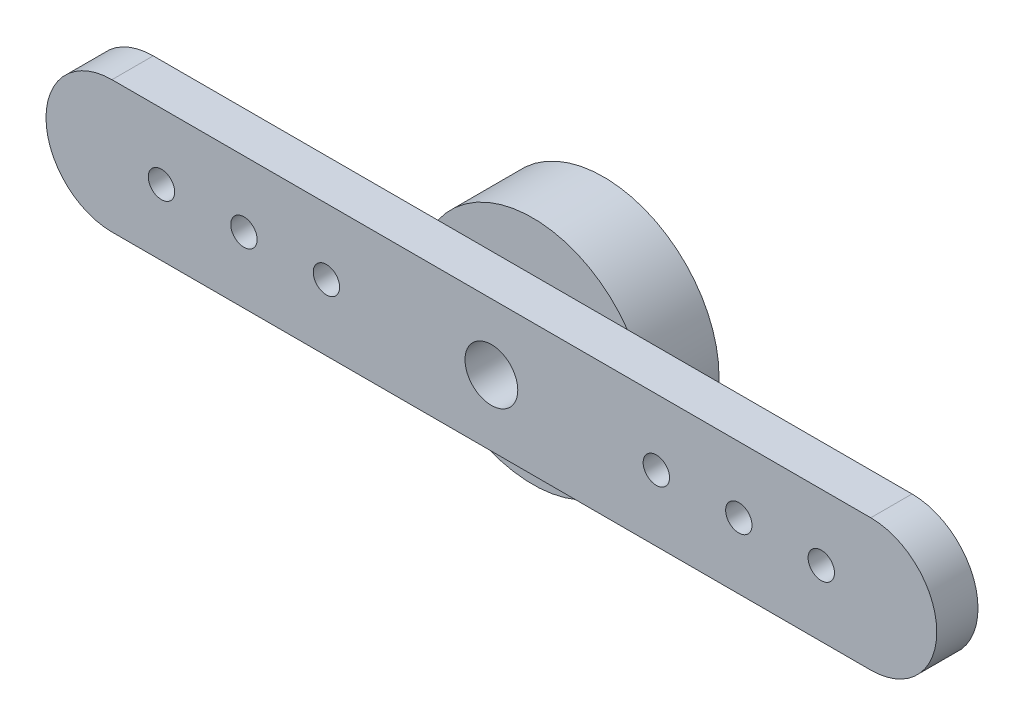
from build123d import *

# Parameters (mm, degrees)
HUB_START   = 2.2
SKETCH1_R   = 7
SKETCH1_R_2 = 3.05
HUB_DEPTH   = 4.3
ARM_START   = 6.5
SKETCH2_R   = 1.6
SKETCH2_R_2 = 0.8
ARM_DEPTH   = 2.5


with BuildPart() as part:
    # Sketch1 → Hub (new body)
    with BuildSketch(Plane.XY.offset(HUB_START)):
        with Locations(Location((0, 0, 0), (0, 0, 180))):
            Circle(SKETCH1_R)
        with Locations(Location((0, 0, 0), (0, 0, 180))):
            Circle(SKETCH1_R_2, mode=Mode.SUBTRACT)
    extrude(amount=HUB_DEPTH)

    # Sketch2 → Arm (add)
    with BuildSketch(Plane.XY.offset(ARM_START)):
        with BuildLine():
            Line((-23, 4), (23, 4))
            ThreePointArc((23, 4), (27, 0), (23, -4))
            Line((23, -4), (-23, -4))
            ThreePointArc((-23, -4), (-27, 0), (-23, 4))
        make_face()
        Circle(SKETCH2_R, mode=Mode.SUBTRACT)
        with Locations((-10, 0)):
            Circle(SKETCH2_R_2, mode=Mode.SUBTRACT)
        with Locations((-15, 0)):
            Circle(SKETCH2_R_2, mode=Mode.SUBTRACT)
        with Locations((-20, 0)):
            Circle(SKETCH2_R_2, mode=Mode.SUBTRACT)
        with Locations((10, 0)):
            Circle(SKETCH2_R_2, mode=Mode.SUBTRACT)
        with Locations((15, 0)):
            Circle(SKETCH2_R_2, mode=Mode.SUBTRACT)
        with Locations((20, 0)):
            Circle(SKETCH2_R_2, mode=Mode.SUBTRACT)
    extrude(amount=ARM_DEPTH)


solid = part.part
